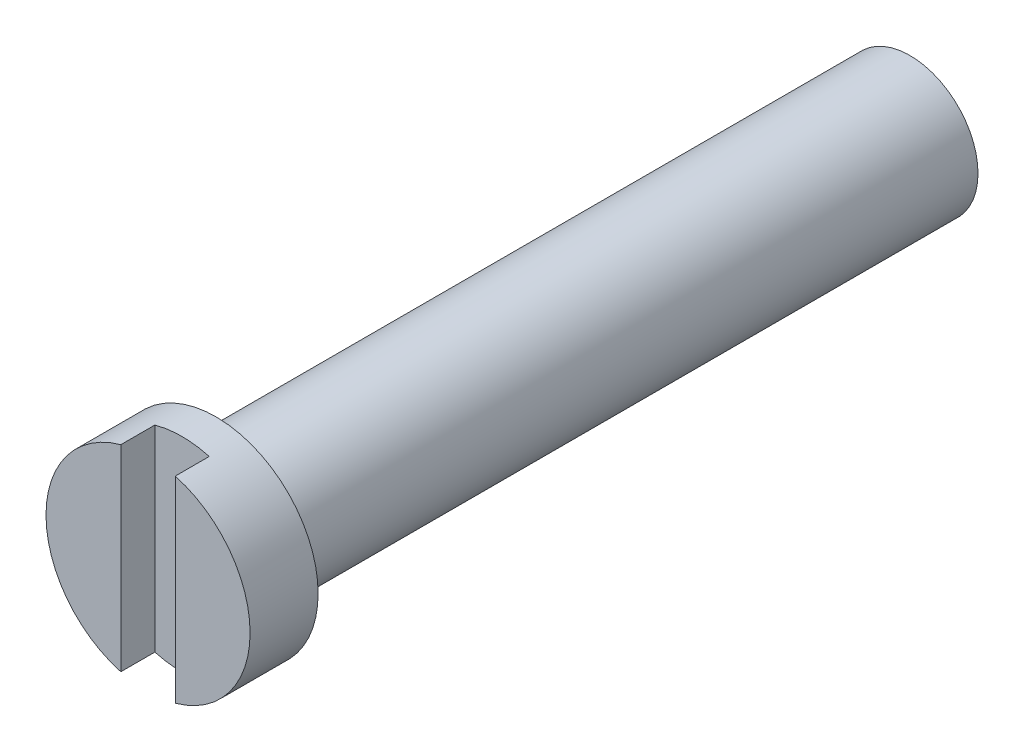
from build123d import *

# Parameters (mm, degrees)
SKETCH2_R           = 1
BOSS_EXTRUDE1_DEPTH = 10.2
SKETCH3_R           = 1.5
BOSS_EXTRUDE2_DEPTH = 1
CUT_EXTRUDE1_START  = -0.5
CUT_EXTRUDE1_DEPTH  = 0.5


with BuildPart() as part:
    # Sketch2 → Boss-Extrude1 (new body)
    with BuildSketch(Plane.XY):
        Circle(SKETCH2_R)
    extrude(amount=BOSS_EXTRUDE1_DEPTH)

    # Sketch3 → Boss-Extrude2 (add)
    with BuildSketch(Plane.XY.offset(10.2)):
        Circle(SKETCH3_R)
    extrude(amount=BOSS_EXTRUDE2_DEPTH)

    # Sketch4 → Cut-Extrude1 (cut)
    with BuildSketch(Plane.XY.offset(11.2).offset(CUT_EXTRUDE1_START)):
        with BuildLine():
            Line((0.4, 1.445683229), (0.4, -1.445683229))
            ThreePointArc((0.4, -1.445683229), (0, -1.5), (-0.4, -1.445683229))
            Line((-0.4, -1.445683229), (-0.4, 1.445683229))
            ThreePointArc((-0.4, 1.445683229), (0, 1.5), (0.4, 1.445683229))
        make_face()
    extrude(amount=CUT_EXTRUDE1_DEPTH, mode=Mode.SUBTRACT)


solid = part.part
